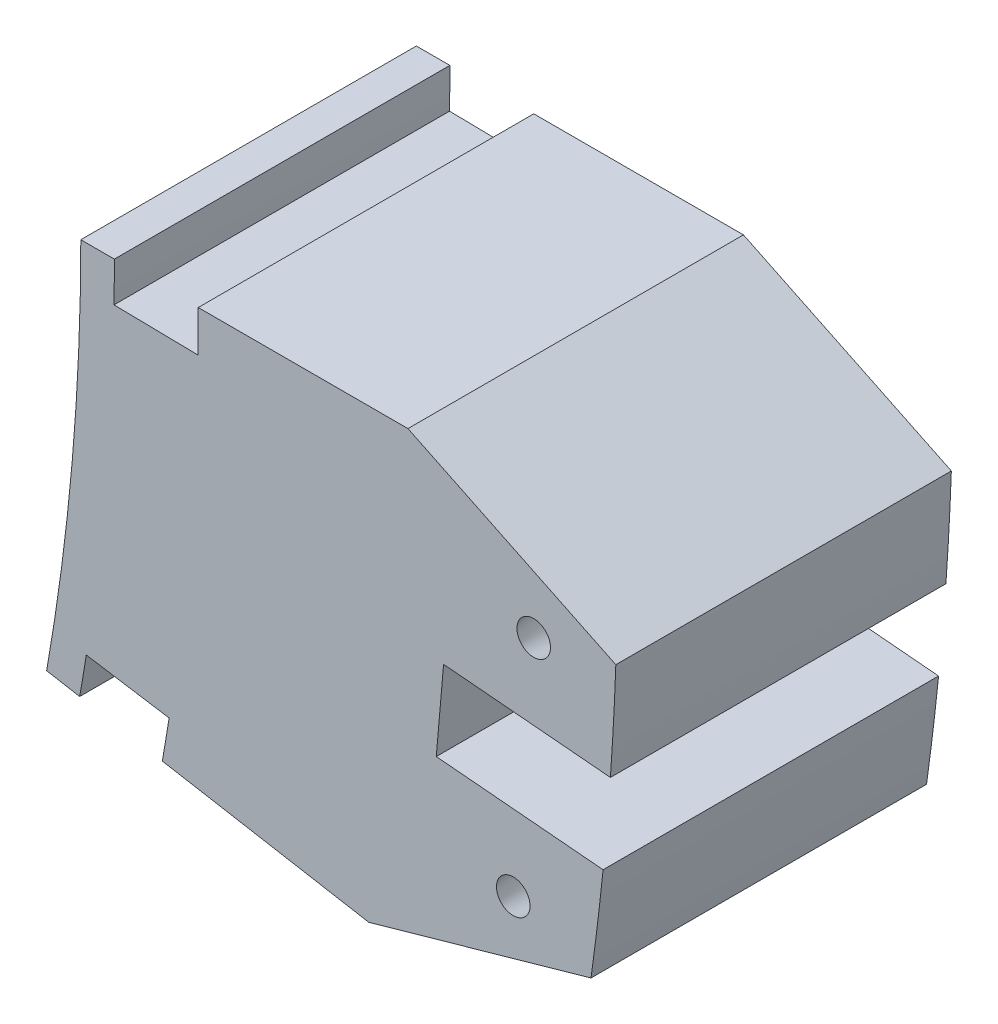
from build123d import *

# Parameters (mm, degrees)
EXTRUDE_1_DEPTH     = 100
CUT_EXTRUDE_1_DEPTH = 849.335356313
CUT_EXTRUDE_2_DEPTH = 849.335356313
CUT_EXTRUDE_3_REACH = 850.335


with BuildPart() as part:
    # 草图1 → 凸台-拉伸1 (new body)
    with BuildSketch(Plane.XY):
        with BuildLine():
            Line((670, 0), (830, 0))
            ThreePointArc((830, 0), (826.841599416, -72.339266481), (817.390435, -144.127987464))
            Line((817.390435, -144.127987464), (659.821194518, -116.344279037))
            ThreePointArc((659.821194518, -116.344279037), (667.450447721, -58.394347641), (670, 0))
        make_face()
    extrude(amount=EXTRUDE_1_DEPTH)

    # 草图3 → 切除-拉伸1 (cut, through all)
    with BuildSketch(Plane.XY.offset(100)):
        with BuildLine():
            Line((778.121311296, -55.529045617), (777.031864512, -67.981479343))
            Line((777.031864512, -67.981479343), (775.942417727, -80.433913069))
            Line((775.942417727, -80.433913069), (825.658378988, -84.783496076))
            ThreePointArc((825.658378988, -84.783496076), (826.841599416, -72.339266481), (827.837272557, -59.878628624))
            Line((827.837272557, -59.878628624), (778.121311296, -55.529045617))
        make_face()
    extrude(amount=-CUT_EXTRUDE_1_DEPTH, mode=Mode.SUBTRACT)

    # 草图5 → 切除-旋转1 (revolve, cut)
    with BuildSketch(Plane(origin=(-3.050450996, -34.866814433, 0), x_dir=(-0.9961946980917455, 0.08715574274765771, 0), z_dir=(-0.08715574274765771, -0.9961946980917455, 0)), mode=Mode.PRIVATE) as cut_revolve_1_sk:
        Polygon((-805, -100), (-810, -100), (-818.682408883, -50.759612349), (-818.682408883, 0), (-805, 0), align=None)
    cut_revolve_1 = revolve(cut_revolve_1_sk.sketch.rotate(Axis((798.886280968, -105.027187345, 0), (0, 0, 1)), 185), axis=Axis((798.886280968, -105.027187345, 0), (0, 0, 1)), mode=Mode.SUBTRACT)

    # 镜向1: 切除-旋转1 across plane
    add(cut_revolve_1.mirror(Plane(origin=(0, 0, 0), x_dir=(0, 0, 1), z_dir=(-0.08715574274765854, -0.9961946980917457, 0))), mode=Mode.SUBTRACT)

    # 草图6 → 切除-拉伸2 (cut, through all)
    with BuildSketch(Plane(origin=(0, 0, 0), x_dir=(-1, 0, 0), z_dir=(0, 0, -1))):
        with BuildLine():
            Line((-669.669272048, -118.080760814), (-694.289465874, -122.421965255))
            ThreePointArc((-694.289465874, -122.421965255), (-695.331349084, -116.358562132), (-696.32028012, -110.286297853))
            Line((-696.32028012, -110.286297853), (-671.628071605, -106.375436227))
            ThreePointArc((-671.628071605, -106.375436227), (-670.674209045, -112.232371985), (-669.669272048, -118.080760814))
        make_face()
        with BuildLine():
            Line((-679.896432706, -11.867636377), (-704.892625085, -12.303946538))
            ThreePointArc((-704.892625085, -12.303946538), (-704.97315576, -6.152207526), (-705, 0))
            Line((-705, 0), (-680, 0))
            ThreePointArc((-680, 0), (-679.974107684, -5.934044139), (-679.896432706, -11.867636377))
        make_face()
    extrude(amount=-CUT_EXTRUDE_2_DEPTH, mode=Mode.SUBTRACT)

    # 草图7 → 切除-拉伸3 (cut, up to next)
    with BuildSketch(Plane.XY.offset(100), mode=Mode.PRIVATE) as cut_extrude_3_sk1:
        with BuildLine():
            Line((767.5, 0), (829.459141918, -29.958836576))
            ThreePointArc((829.459141918, -29.958836576), (829.864774464, -14.981859167), (830, 0))
            Line((830, 0), (767.5, 0))
        make_face()
    cut_extrude_3_tool1 = extrude(cut_extrude_3_sk1.sketch, amount=-CUT_EXTRUDE_3_REACH, mode=Mode.PRIVATE) & part.part
    # 草图7 → 切除-拉伸3 (cut, up to next)
    with BuildSketch(Plane.XY.offset(100), mode=Mode.PRIVATE) as cut_extrude_3_sk2:
        with BuildLine():
            Line((822.060091144, -114.530373912), (755.839950437, -133.274976359))
            Line((755.839950437, -133.274976359), (817.390435, -144.127987464))
            ThreePointArc((817.390435, -144.127987464), (819.858836386, -129.350254733), (822.060091144, -114.530373912))
        make_face()
    cut_extrude_3_tool2 = extrude(cut_extrude_3_sk2.sketch, amount=-CUT_EXTRUDE_3_REACH, mode=Mode.PRIVATE) & part.part
    add(cut_extrude_3_tool1.solids().sort_by_distance((809.046215, -10.000647, 100))[0], mode=Mode.SUBTRACT)
    add(cut_extrude_3_tool2.solids().sort_by_distance((798.491579, -130.640686, 100))[0], mode=Mode.SUBTRACT)


solid = part.part
